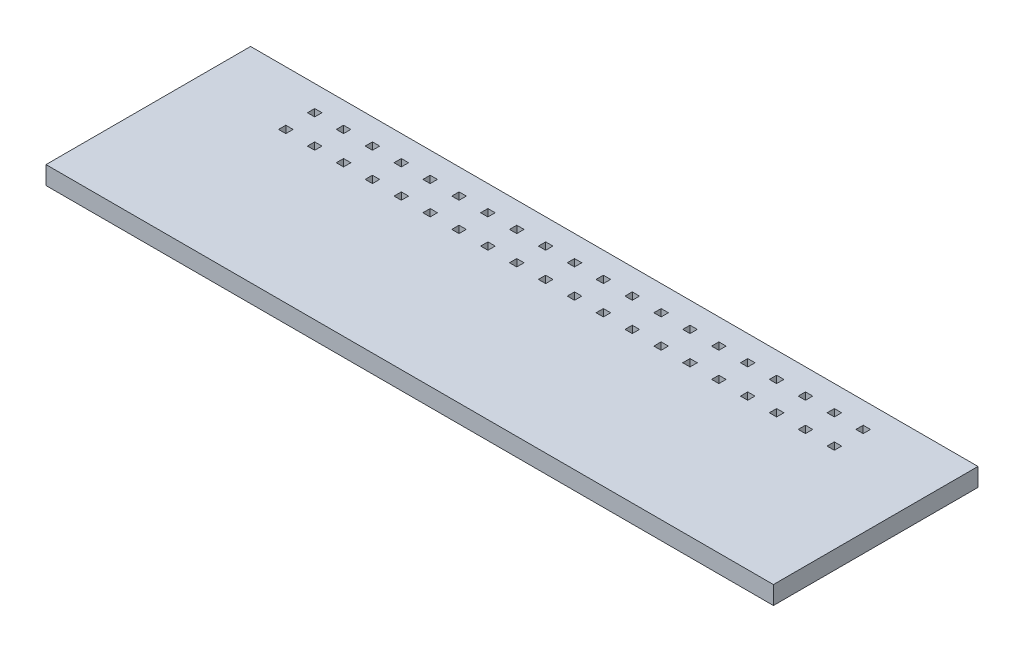
from build123d import *

# Parameters (mm, degrees)
SKETCH1_W           = 64
SKETCH1_H           = 18
BOSS_EXTRUDE1_DEPTH = 1.6
SKETCH2_W           = 0.64
SKETCH2_H           = 0.64
CUT_EXTRUDE2_DEPTH  = 34.280024038


with BuildPart() as part:
    # Sketch1 → Boss-Extrude1 (new body)
    with BuildSketch(Plane(origin=(0, 0, 0), x_dir=(1, 0, 0), z_dir=(0, 1, 0))):
        Rectangle(SKETCH1_W, SKETCH1_H)
    extrude(amount=BOSS_EXTRUDE1_DEPTH)

    # Sketch2 → Cut-Extrude2 (cut, through all)
    with BuildSketch(Plane(origin=(0, 1.6, 0), x_dir=(1, 0, 0), z_dir=(0, 1, 0))):
        with Locations((-21.59, 6.77)):
            Rectangle(SKETCH2_W, SKETCH2_H)
        with Locations((-24.13, 6.77)):
            Rectangle(SKETCH2_W, SKETCH2_H)
        with Locations((-24.13, 4.23)):
            Rectangle(SKETCH2_W, SKETCH2_H)
        with Locations((-21.59, 4.23)):
            Rectangle(SKETCH2_W, SKETCH2_H)
        with Locations((-19.05, 6.77)):
            Rectangle(SKETCH2_W, SKETCH2_H)
        with Locations((-19.05, 4.23)):
            Rectangle(SKETCH2_W, SKETCH2_H)
        with Locations((-16.51, 4.23)):
            Rectangle(SKETCH2_W, SKETCH2_H)
        with Locations((-16.51, 6.77)):
            Rectangle(SKETCH2_W, SKETCH2_H)
        with Locations((-13.97, 6.77)):
            Rectangle(SKETCH2_W, SKETCH2_H)
        with Locations((-13.97, 4.23)):
            Rectangle(SKETCH2_W, SKETCH2_H)
        with Locations((-11.43, 6.77)):
            Rectangle(SKETCH2_W, SKETCH2_H)
        with Locations((-11.43, 4.23)):
            Rectangle(SKETCH2_W, SKETCH2_H)
        with Locations((-8.89, 6.77)):
            Rectangle(SKETCH2_W, SKETCH2_H)
        with Locations((-8.89, 4.23)):
            Rectangle(SKETCH2_W, SKETCH2_H)
        with Locations((-6.35, 4.23)):
            Rectangle(SKETCH2_W, SKETCH2_H)
        with Locations((-6.35, 6.77)):
            Rectangle(SKETCH2_W, SKETCH2_H)
        with Locations((-3.81, 6.77)):
            Rectangle(SKETCH2_W, SKETCH2_H)
        with Locations((-3.81, 4.23)):
            Rectangle(SKETCH2_W, SKETCH2_H)
        with Locations((-1.27, 4.23)):
            Rectangle(SKETCH2_W, SKETCH2_H)
        with Locations((1.27, 4.23)):
            Rectangle(SKETCH2_W, SKETCH2_H)
        with Locations((-1.27, 6.77)):
            Rectangle(SKETCH2_W, SKETCH2_H)
        with Locations((1.27, 6.77)):
            Rectangle(SKETCH2_W, SKETCH2_H)
        with Locations((3.81, 6.77)):
            Rectangle(SKETCH2_W, SKETCH2_H)
        with Locations((3.81, 4.23)):
            Rectangle(SKETCH2_W, SKETCH2_H)
        with Locations((6.35, 4.23)):
            Rectangle(SKETCH2_W, SKETCH2_H)
        with Locations((8.89, 4.23)):
            Rectangle(SKETCH2_W, SKETCH2_H)
        with Locations((6.35, 6.77)):
            Rectangle(SKETCH2_W, SKETCH2_H)
        with Locations((8.89, 6.77)):
            Rectangle(SKETCH2_W, SKETCH2_H)
        with Locations((11.43, 6.77)):
            Rectangle(SKETCH2_W, SKETCH2_H)
        with Locations((11.43, 4.23)):
            Rectangle(SKETCH2_W, SKETCH2_H)
        with Locations((13.97, 6.77)):
            Rectangle(SKETCH2_W, SKETCH2_H)
        with Locations((13.97, 4.23)):
            Rectangle(SKETCH2_W, SKETCH2_H)
        with Locations((16.51, 6.77)):
            Rectangle(SKETCH2_W, SKETCH2_H)
        with Locations((16.51, 4.23)):
            Rectangle(SKETCH2_W, SKETCH2_H)
        with Locations((19.05, 6.77)):
            Rectangle(SKETCH2_W, SKETCH2_H)
        with Locations((19.05, 4.23)):
            Rectangle(SKETCH2_W, SKETCH2_H)
        with Locations((21.59, 6.77)):
            Rectangle(SKETCH2_W, SKETCH2_H)
        with Locations((21.59, 4.23)):
            Rectangle(SKETCH2_W, SKETCH2_H)
        with Locations((24.13, 4.23)):
            Rectangle(SKETCH2_W, SKETCH2_H)
        with Locations((24.13, 6.77)):
            Rectangle(SKETCH2_W, SKETCH2_H)
    extrude(amount=-CUT_EXTRUDE2_DEPTH, mode=Mode.SUBTRACT)


solid = part.part
